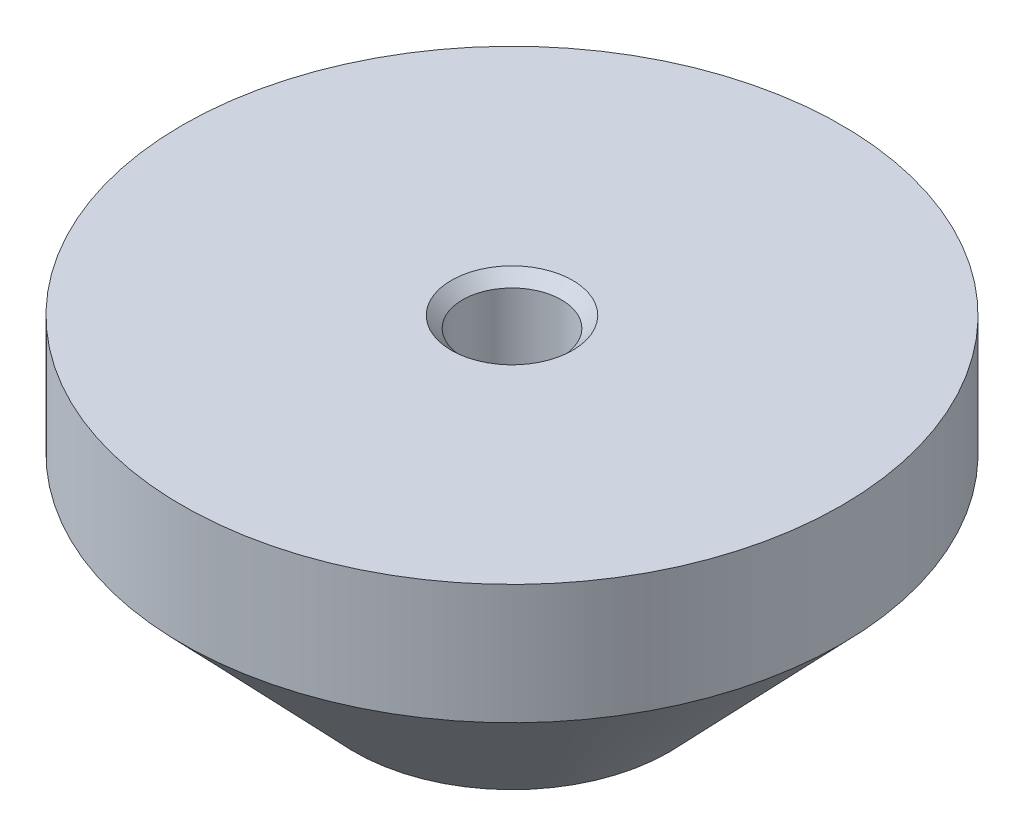
from build123d import *

# Parameters (mm, degrees)
M4X0_7_TAPPED_HOLE1_D           = 3.3
M4X0_7_TAPPED_HOLE1_DEPTH       = 6.508579979
M4X0_7_TAPPED_HOLE1_CSINK_D     = 4.05
M4X0_7_TAPPED_HOLE1_CSINK_ANGLE = 90
M4X0_7_TAPPED_HOLE1_TIP         = 0.991420021


with BuildPart() as part:
    # Sketch1 → Revolve1 (revolve)
    with BuildSketch(Plane.XY, mode=Mode.PRIVATE) as revolve1_sk:
        with BuildLine():
            Line((0, 0), (-11, 0))
            Line((-11, 0), (-11, -4))
            Line((-11, -4), (-5.25, -10))
            Line((-5.25, -10), (-4.5, -10))
            Line((-4.5, -10), (-4.5, -8.3))
            Line((-4.5, -8.3), (-4.2, -8.3))
            ThreePointArc((-4.2, -8.3), (-2.969848481, -11.269848481), (0, -12.5))
            Line((0, -12.5), (0, 0))
        make_face()
    revolve(revolve1_sk.sketch.rotate(Axis((0, -12.5, 0), (0, 1, 0)), 180), axis=Axis((0, -12.5, 0), (0, 1, 0)))

    # M4x0.7 Tapped Hole1
    with Locations(Plane(origin=(0, 0, 0), x_dir=(1, 0, 0), z_dir=(0, 1, 0))):
        with Locations((0, 0)):
            CounterSinkHole(M4X0_7_TAPPED_HOLE1_D / 2, M4X0_7_TAPPED_HOLE1_CSINK_D / 2, depth=M4X0_7_TAPPED_HOLE1_DEPTH, counter_sink_angle=M4X0_7_TAPPED_HOLE1_CSINK_ANGLE)
            with Locations((0, 0, -(M4X0_7_TAPPED_HOLE1_DEPTH + M4X0_7_TAPPED_HOLE1_TIP / 2))):  # 118° drill point
                Cone(0, M4X0_7_TAPPED_HOLE1_D / 2, M4X0_7_TAPPED_HOLE1_TIP, mode=Mode.SUBTRACT)


solid = part.part
